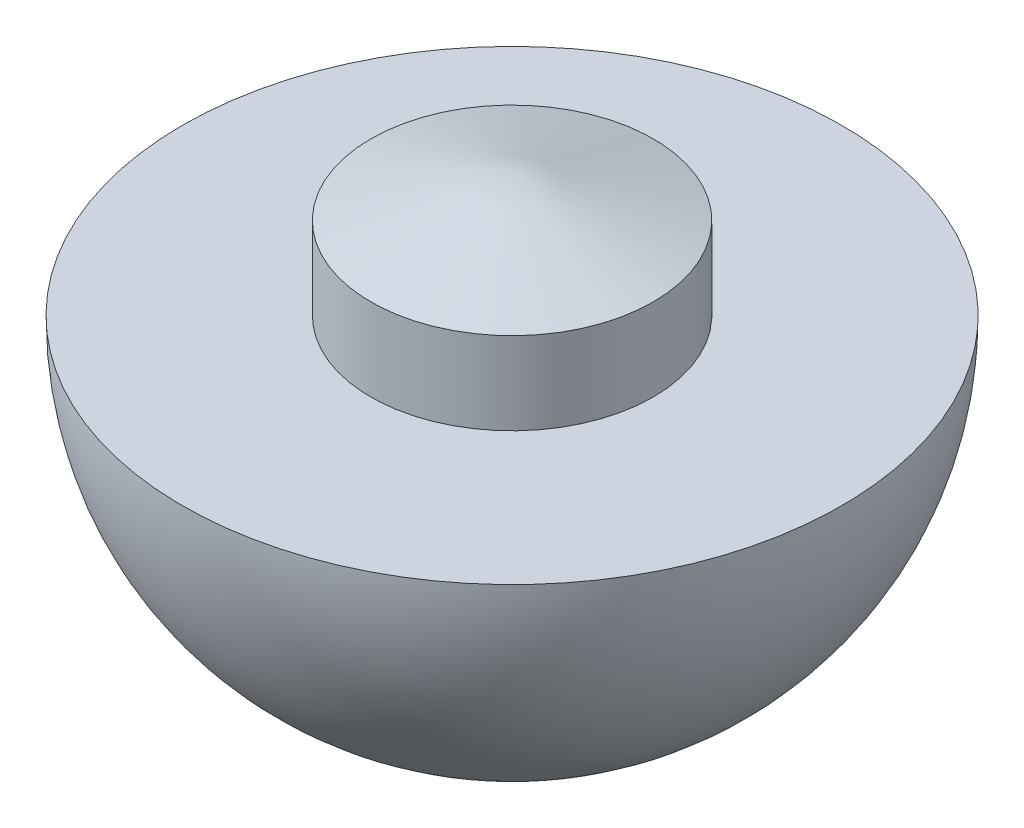
from build123d import *


with BuildPart() as part:
    # Sketch1 → Revolve1 (revolve)
    with BuildSketch(Plane.XY):
        with BuildLine():
            Line((-1.778, 1.1049), (0.254, 1.1049))
            Line((0.254, 1.1049), (0.254, 1.9939))
            Line((0.254, 1.9939), (1.778, 2.4511))
            Line((1.778, 2.4511), (1.778, -2.4511))
            ThreePointArc((1.778, -2.4511), (-0.736471714, -1.409571714), (-1.778, 1.1049))
        make_face()
    revolve(axis=Axis((1.778, 2.4511, 0), (0, -1, 0)))


solid = part.part
